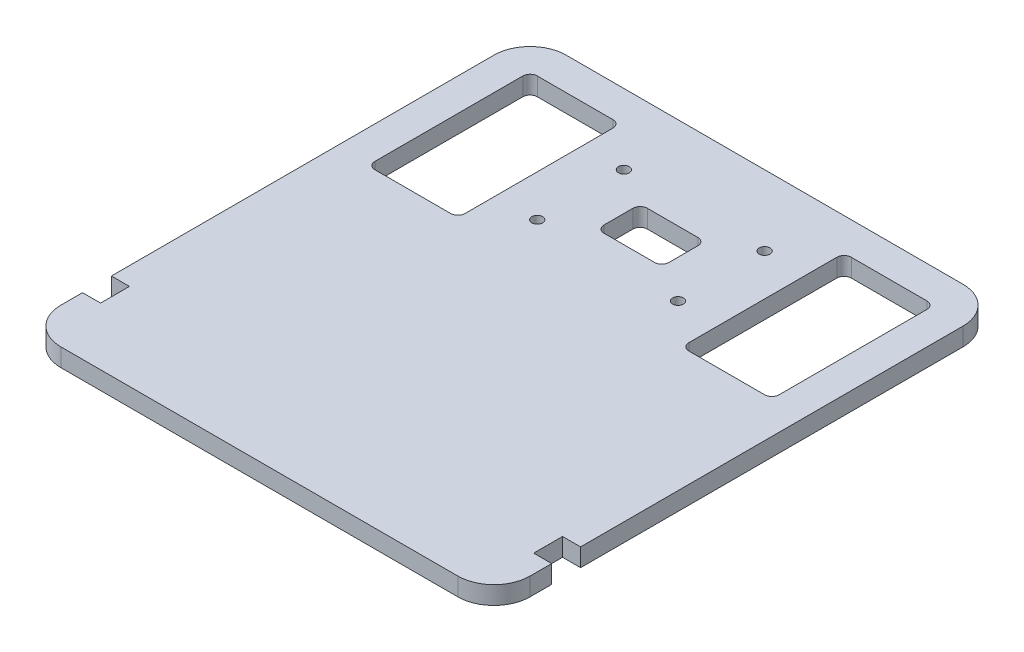
from build123d import *

# Parameters (mm, degrees)
RESSALTO_EXTRUS_O1_DEPTH = 5
CORTE_EXTRUS_O1_DEPTH    = 5
ESBO_O4_R                = 1.5
CORTE_EXTRUS_O2_DEPTH    = 10
ESBO_O6_W                = 8
ESBO_O6_H                = 5
CORTE_EXTRUS_O3_DEPTH    = 5
CORTE_EXTRUS_O4_DEPTH    = 10
ESBO_O9_W                = 8
ESBO_O9_H                = 5
CORTE_EXTRUS_O5_DEPTH    = 5


with BuildPart() as part:
    # Esboço1 → Ressalto-extrusão1 (new body)
    with BuildSketch(Plane(origin=(0, 0, 0), x_dir=(1, 0, 0), z_dir=(0, 1, 0))):
        with BuildLine():
            Line((-43.336132643, 103.024644241), (66.663867357, 103.024644241))
            ThreePointArc((66.663867357, 103.024644241), (73.734935168, 100.095712053), (76.663867357, 93.024644241))
            Line((76.663867357, 93.024644241), (76.663867357, -26.975355759))
            ThreePointArc((76.663867357, -26.975355759), (73.734935168, -34.046423571), (66.663867357, -36.975355759))
            Line((66.663867357, -36.975355759), (-43.336132643, -36.975355759))
            ThreePointArc((-43.336132643, -36.975355759), (-50.407200455, -34.046423571), (-53.336132643, -26.975355759))
            Line((-53.336132643, -26.975355759), (-53.336132643, 93.024644241))
            ThreePointArc((-53.336132643, 93.024644241), (-50.407200455, 100.095712053), (-43.336132643, 103.024644241))
        make_face()
    extrude(amount=RESSALTO_EXTRUS_O1_DEPTH)

    # Esboço2 → Corte-extrusão1 (cut)
    with BuildSketch(Plane(origin=(0, 5, 0), x_dir=(1, 0, 0), z_dir=(0, 1, 0))):
        with BuildLine():
            Line((-42.336132643, 94.024644241), (-21.336132643, 94.024644241))
            ThreePointArc((-21.336132643, 94.024644241), (-19.921919081, 93.438857803), (-19.336132643, 92.024644241))
            Line((-19.336132643, 92.024644241), (-19.336132643, 51.024644241))
            ThreePointArc((-19.336132643, 51.024644241), (-19.921919081, 49.610430679), (-21.336132643, 49.024644241))
            Line((-21.336132643, 49.024644241), (-42.336132643, 49.024644241))
            ThreePointArc((-42.336132643, 49.024644241), (-43.750346206, 49.610430679), (-44.336132643, 51.024644241))
            Line((-44.336132643, 51.024644241), (-44.336132643, 92.024644241))
            ThreePointArc((-44.336132643, 92.024644241), (-43.750346206, 93.438857803), (-42.336132643, 94.024644241))
        make_face()
        with BuildLine():
            Line((44.663867357, 94.024644241), (65.663867357, 94.024644241))
            ThreePointArc((65.663867357, 94.024644241), (67.078080919, 93.438857803), (67.663867357, 92.024644241))
            Line((67.663867357, 92.024644241), (67.663867357, 51.024644241))
            ThreePointArc((67.663867357, 51.024644241), (67.078080919, 49.610430679), (65.663867357, 49.024644241))
            Line((65.663867357, 49.024644241), (44.663867357, 49.024644241))
            ThreePointArc((44.663867357, 49.024644241), (43.249653794, 49.610430679), (42.663867357, 51.024644241))
            Line((42.663867357, 51.024644241), (42.663867357, 92.024644241))
            ThreePointArc((42.663867357, 92.024644241), (43.249653794, 93.438857803), (44.663867357, 94.024644241))
        make_face()
    extrude(amount=-CORTE_EXTRUS_O1_DEPTH, mode=Mode.SUBTRACT)

    # Esboço4 → Corte-extrusão2 (cut)
    with BuildSketch(Plane(origin=(0, 5, 0), x_dir=(1, 0, 0), z_dir=(0, 1, 0))):
        with Locations(Location((-7.836132643, 59.524644241, 0), (0, 0, 270))):
            Circle(ESBO_O4_R)
        with Locations(Location((31.163867357, 59.524644241, 0), (0, 0, 270))):
            Circle(ESBO_O4_R)
        with Locations(Location((-7.836132643, 83.524644241, 0), (0, 0, 270))):
            Circle(ESBO_O4_R)
        with Locations(Location((31.163867357, 83.524644241, 0), (0, 0, 270))):
            Circle(ESBO_O4_R)
    extrude(amount=-CORTE_EXTRUS_O2_DEPTH, mode=Mode.SUBTRACT)

    # Esboço6 → Corte-extrusão3 (cut)
    with BuildSketch(Plane.ZY.offset(53.336132643)):
        with Locations((16.975355759, 2.5)):
            Rectangle(ESBO_O6_W, ESBO_O6_H)
    extrude(amount=-CORTE_EXTRUS_O3_DEPTH, mode=Mode.SUBTRACT)

    # Esboço7 → Corte-extrusão4 (cut)
    with BuildSketch(Plane.XZ):
        with BuildLine():
            Line((18.663867357, -77.524644241), (4.663867357, -77.524644241))
            ThreePointArc((4.663867357, -77.524644241), (3.249653794, -76.938857803), (2.663867357, -75.524644241))
            Line((2.663867357, -75.524644241), (2.663867357, -67.524644241))
            ThreePointArc((2.663867357, -67.524644241), (3.249653794, -66.110430679), (4.663867357, -65.524644241))
            Line((4.663867357, -65.524644241), (18.663867357, -65.524644241))
            ThreePointArc((18.663867357, -65.524644241), (20.078080919, -66.110430679), (20.663867357, -67.524644241))
            Line((20.663867357, -67.524644241), (20.663867357, -75.524644241))
            ThreePointArc((20.663867357, -75.524644241), (20.078080919, -76.938857803), (18.663867357, -77.524644241))
        make_face()
    extrude(amount=-CORTE_EXTRUS_O4_DEPTH, mode=Mode.SUBTRACT)

    # Esboço9 → Corte-extrusão5 (cut)
    with BuildSketch(Plane(origin=(76.663867357, 0, 0), x_dir=(0, 0, -1), z_dir=(1, 0, 0))):
        with Locations((-16.975355759, 2.5)):
            Rectangle(ESBO_O9_W, ESBO_O9_H)
    extrude(amount=-CORTE_EXTRUS_O5_DEPTH, mode=Mode.SUBTRACT)


solid = part.part
